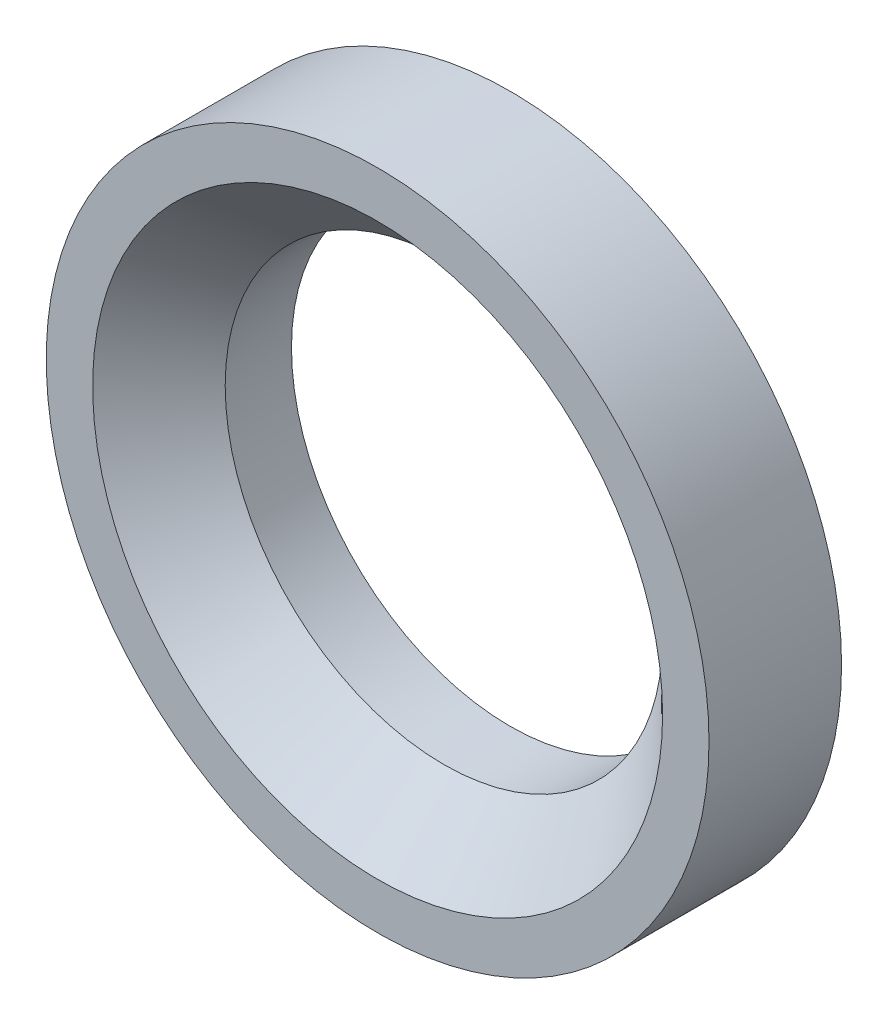
from build123d import *

# Parameters (mm, degrees)
SKETCH1_R           = 6.35
SKETCH1_R_2         = 4.191
BOSS_EXTRUDE1_DEPTH = 2.54
CHAMFER1_SIZE       = 1.27


with BuildPart() as part:
    # Sketch1 → Boss-Extrude1 (new body)
    with BuildSketch(Plane.XY):
        Circle(SKETCH1_R)
        Circle(SKETCH1_R_2, mode=Mode.SUBTRACT)
    extrude(amount=BOSS_EXTRUDE1_DEPTH)

    # Chamfer1
    chamfer1_edges = [part.edges().sort_by_distance(p)[0] for p in [
        (-4.191, 0, 2.54),
    ]]
    chamfer(chamfer1_edges, length=CHAMFER1_SIZE)


solid = part.part
